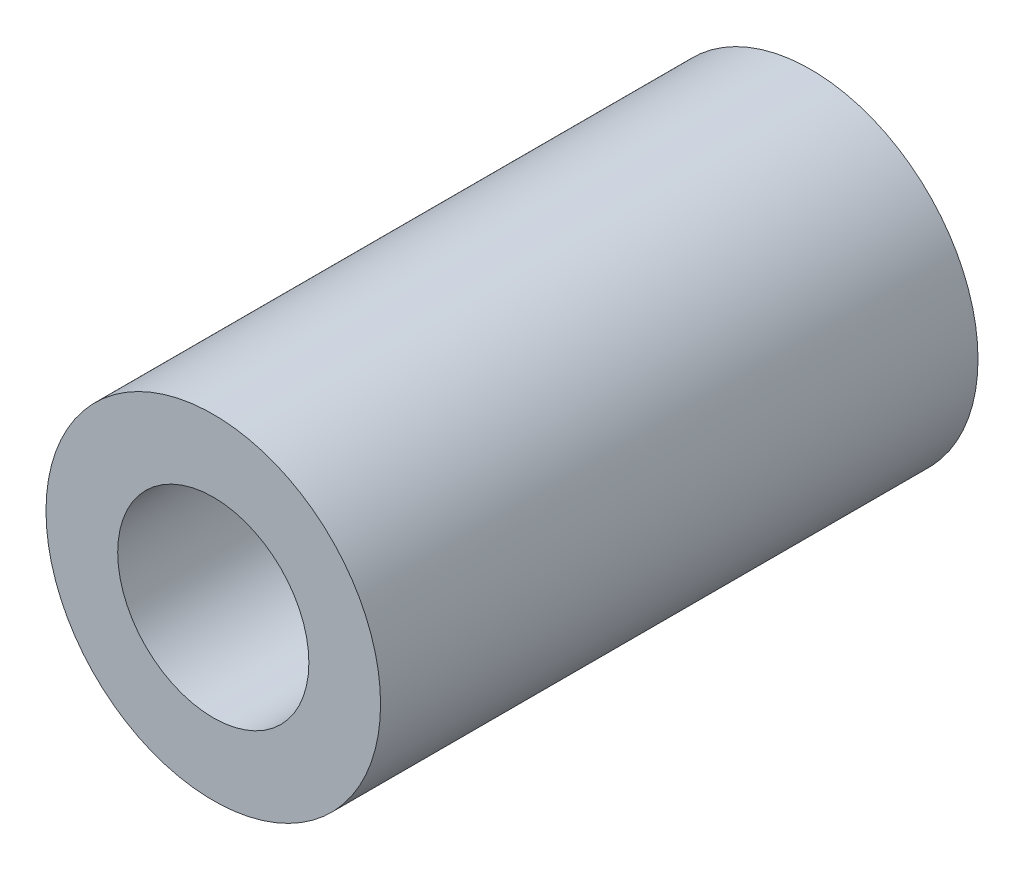
from build123d import *

# Parameters (mm, degrees)
SKETCH1_R           = 7
SKETCH1_R_2         = 3
BOSS_EXTRUDE1_DEPTH = 25
SKETCH3_R           = 4
CUT_EXTRUDE1_DEPTH  = 13


with BuildPart() as part:
    # Sketch1 → Boss-Extrude1 (new body)
    with BuildSketch(Plane(origin=(0, 0, 0), x_dir=(0, 1, 0), z_dir=(0, 0, 1))):
        with Locations(Location((0, 0, 0), (0, 0, 270))):
            Circle(SKETCH1_R)
        with Locations(Location((0, 0, 0), (0, 0, 270))):
            Circle(SKETCH1_R_2, mode=Mode.SUBTRACT)
    extrude(amount=BOSS_EXTRUDE1_DEPTH)

    # Sketch3 → Cut-Extrude1 (cut)
    with BuildSketch(Plane.XY.offset(25)):
        Circle(SKETCH3_R)
    extrude(amount=-CUT_EXTRUDE1_DEPTH, mode=Mode.SUBTRACT)


solid = part.part
